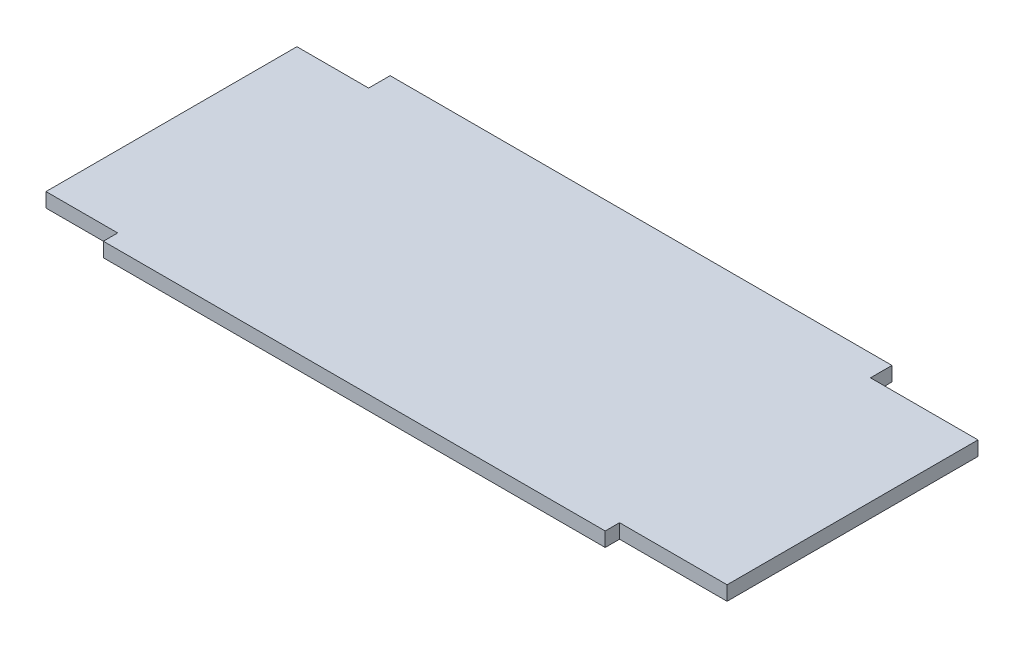
from build123d import *

# Parameters (mm, degrees)
ESTRUSIONE_ESTRUSIONE1_DEPTH      = 37
ESTRUSIONE_ESTRUSIONE1_DEPTH_BACK = 3
SCHIZZO1_W                        = 70
SCHIZZO1_H                        = 2
SCHIZZO2_W                        = 35
SCHIZZO2_H                        = 2
ESTRUSIONE_ESTRUSIONE2_DEPTH      = 15
SCHIZZO3_W                        = 35
SCHIZZO3_H                        = 2
ESTRUSIONE_ESTRUSIONE3_DEPTH      = 10


with BuildPart() as part:
    # Schizzo1 → Estrusione-Estrusione1 (new, two sides: drawn at the far end of the back side and taken through both)
    with BuildSketch(Plane.XY.offset(-ESTRUSIONE_ESTRUSIONE1_DEPTH_BACK)):
        with Locations((113, -73.5)):
            Rectangle(SCHIZZO1_W, SCHIZZO1_H)
    extrude(amount=ESTRUSIONE_ESTRUSIONE1_DEPTH + ESTRUSIONE_ESTRUSIONE1_DEPTH_BACK)

    # Schizzo2 → Estrusione-Estrusione2 (add)
    with BuildSketch(Plane(origin=(148, 0, 0), x_dir=(0, 0, -1), z_dir=(1, 0, 0))):
        with Locations((-17.5, -73.5)):
            Rectangle(SCHIZZO2_W, SCHIZZO2_H)
    extrude(amount=ESTRUSIONE_ESTRUSIONE2_DEPTH)

    # Schizzo3 → Estrusione-Estrusione3 (add)
    with BuildSketch(Plane.ZY.offset(-78)):
        with Locations((17.5, -73.5)):
            Rectangle(SCHIZZO3_W, SCHIZZO3_H)
    extrude(amount=ESTRUSIONE_ESTRUSIONE3_DEPTH)


solid = part.part
